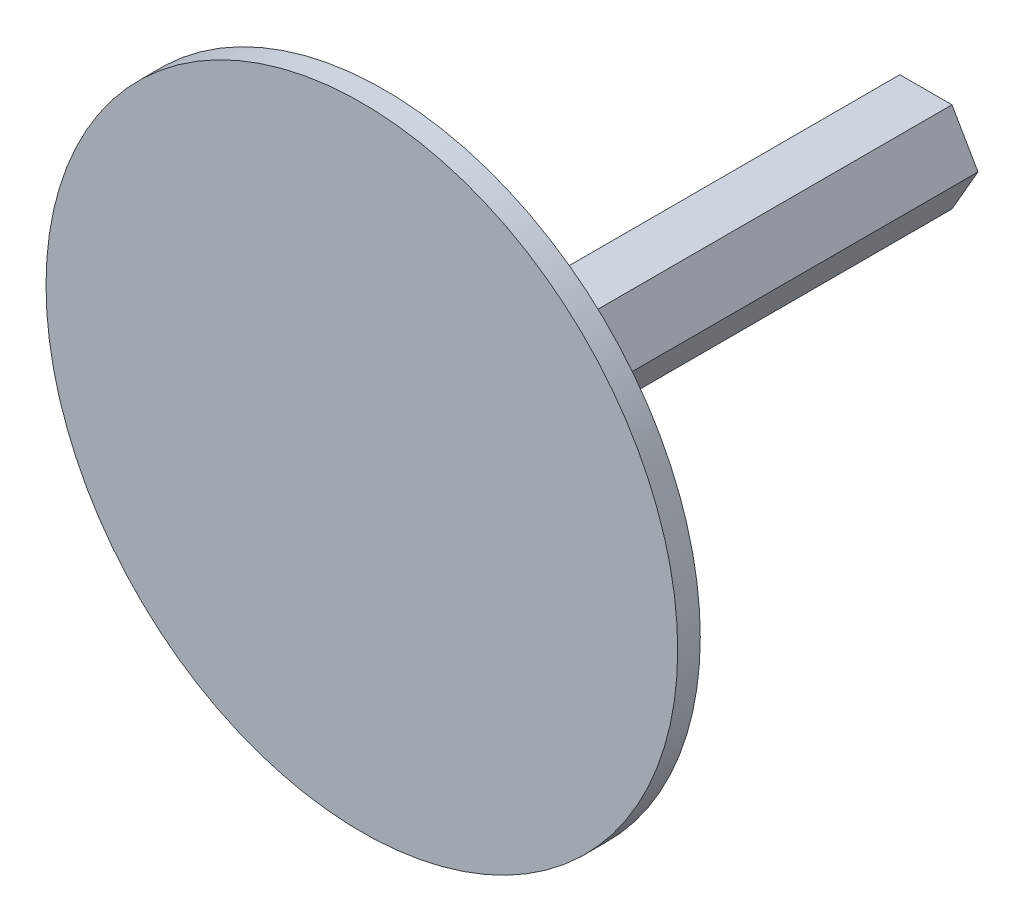
from build123d import *

# Parameters (mm, degrees)
BOSS_EXTRUDE1_DEPTH = 76.2
SKETCH2_R           = 44.45
BOSS_EXTRUDE2_DEPTH = 3.175


with BuildPart() as part:
    # Sketch1 → Boss-Extrude1 (new body)
    with BuildSketch(Plane.XY):
        Polygon((7.332348419, 0), (3.666174209, 6.35), (-3.666174209, 6.35), (-7.332348419, 0), (-3.666174209, -6.35), (3.666174209, -6.35), align=None)
    extrude(amount=-BOSS_EXTRUDE1_DEPTH)

    # Sketch2 → Boss-Extrude2 (add)
    with BuildSketch(Plane.XY):
        Circle(SKETCH2_R)
    extrude(amount=BOSS_EXTRUDE2_DEPTH)


solid = part.part
